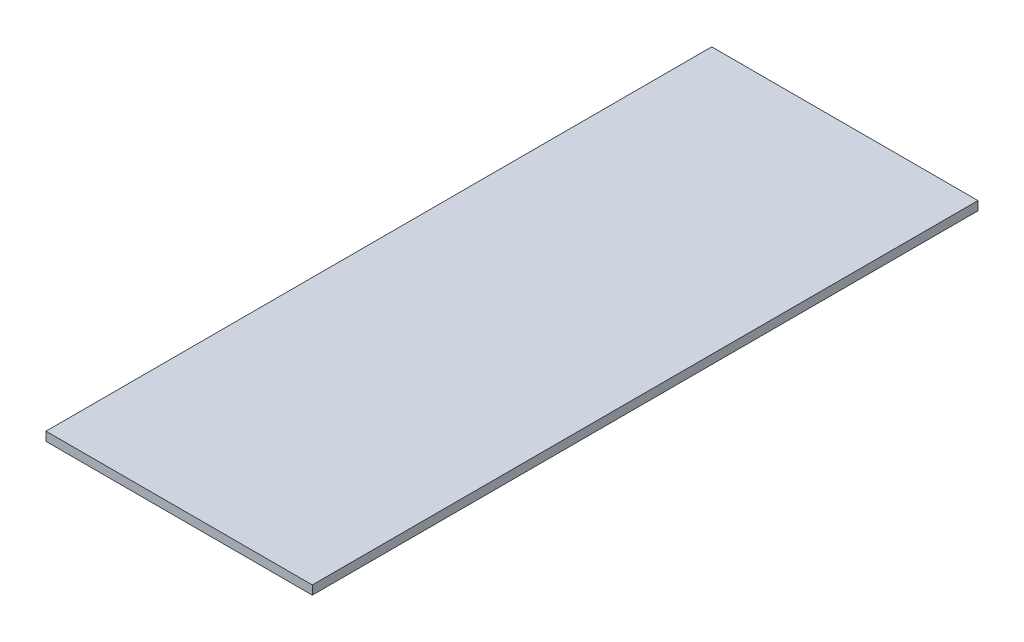
from build123d import *

# Parameters (mm, degrees)
CROQUIS1_W              = 300
CROQUIS1_H              = 750
SALIENTE_EXTRUIR1_DEPTH = 10


with BuildPart() as part:
    # Croquis1 → Saliente-Extruir1 (new body)
    with BuildSketch(Plane(origin=(0, 0, 0), x_dir=(1, 0, 0), z_dir=(0, 1, 0))):
        Rectangle(CROQUIS1_W, CROQUIS1_H)
    extrude(amount=SALIENTE_EXTRUIR1_DEPTH)


solid = part.part
